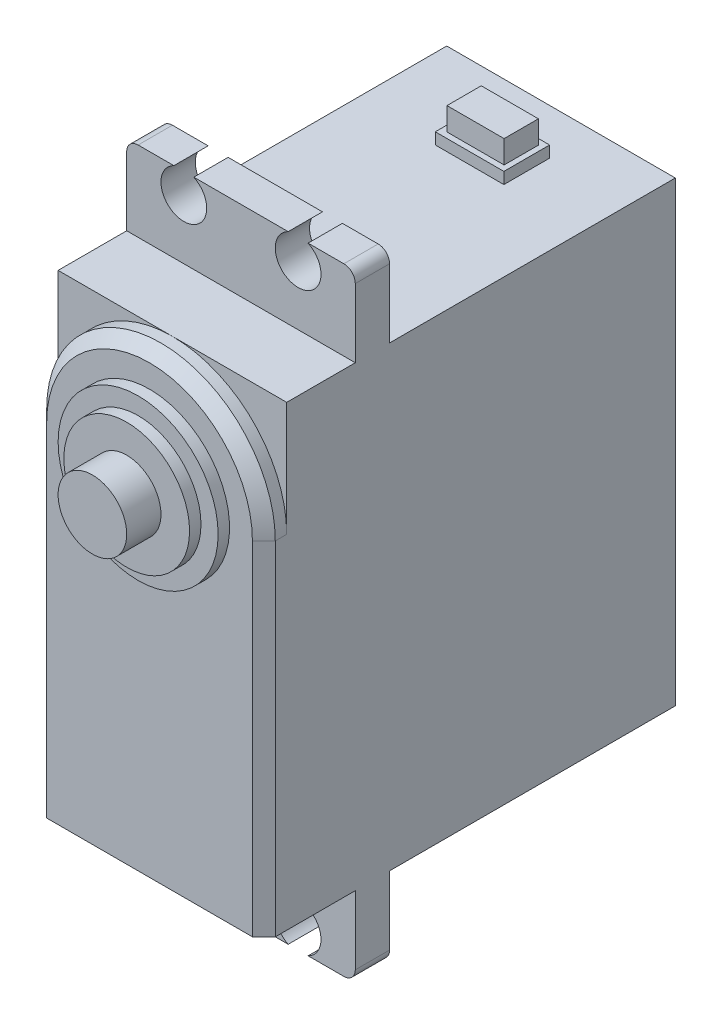
from build123d import *

# Parameters (mm, degrees)
SKETCH1_W            = 20
SKETCH1_H            = 40
BOSS_EXTRUDE1_DEPTH  = 36
CHAMFER1_SIZE        = 2
BOSS_EXTRUDE7_DEPTH  = 3
FILLET1_R            = 1
FILLET2_R            = 1
SKETCH3_W            = 6
SKETCH3_H            = 4
BOSS_EXTRUDE8_DEPTH  = 1
SKETCH4_W            = 5
SKETCH4_H            = 3
BOSS_EXTRUDE9_DEPTH  = 2
BOSS_EXTRUDE10_DEPTH = 2
CHAMFER2_SIZE        = 1
SKETCH6_R            = 7
BOSS_EXTRUDE11_DEPTH = 1
SKETCH7_R            = 5.5
BOSS_EXTRUDE12_DEPTH = 1
SKETCH8_R            = 3
BOSS_EXTRUDE13_DEPTH = 3


with BuildPart() as part:
    # Sketch1 → Boss-Extrude1 (new body)
    with BuildSketch(Plane.XY):
        Rectangle(SKETCH1_W, SKETCH1_H)
    extrude(amount=BOSS_EXTRUDE1_DEPTH)

    # Chamfer1
    chamfer1_edges = [part.edges().sort_by_distance(p)[0] for p in [
        (0, 20, 0),
        (-10, 0, 0),
        (0, -20, 0),
        (10, 0, 0),
    ]]
    chamfer(chamfer1_edges, length=CHAMFER1_SIZE)

    # Sketch2 → Boss-Extrude7 (add)
    with BuildSketch(Plane.XY.offset(27)):
        with BuildLine():
            Line((-10, 20), (10, 20))
            Line((10, 20), (10, 27))
            Line((10, 27), (5.871779789, 27))
            ThreePointArc((5.871779789, 27), (5, 23.2), (4.128220211, 27))
            Line((4.128220211, 27), (-4.128220211, 27))
            ThreePointArc((-4.128220211, 27), (-5, 23.2), (-5.871779789, 27))
            Line((-5.871779789, 27), (-10, 27))
            Line((-10, 27), (-10, 20))
        make_face()
    boss_extrude7 = extrude(amount=BOSS_EXTRUDE7_DEPTH)

    # Fillet1
    fillet1_edges = [part.edges().sort_by_distance(p)[0] for p in [
        (10, 27, 28.5),
        (-10, 27, 28.5),
    ]]
    fillet(fillet1_edges, radius=FILLET1_R)

    # Mirror1: Boss-Extrude7 across plane
    add(boss_extrude7.mirror(Plane.ZX))

    # Fillet2
    fillet2_edges = [part.edges().sort_by_distance(p)[0] for p in [
        (-10, -27, 28.5),
        (10, -27, 28.5),
    ]]
    fillet(fillet2_edges, radius=FILLET2_R)

    # Sketch3 → Boss-Extrude8 (add)
    with BuildSketch(Plane(origin=(0, 20, 0), x_dir=(1, 0, 0), z_dir=(0, 1, 0))):
        with Locations((0, -8)):
            Rectangle(SKETCH3_W, SKETCH3_H)
    extrude(amount=BOSS_EXTRUDE8_DEPTH)

    # Sketch4 → Boss-Extrude9 (add)
    with BuildSketch(Plane(origin=(0, 21, 0), x_dir=(1, 0, 0), z_dir=(0, 1, 0))):
        with Locations((0.024838868, -8.004270903)):
            Rectangle(SKETCH4_W, SKETCH4_H)
    extrude(amount=BOSS_EXTRUDE9_DEPTH)

    # Sketch5 → Boss-Extrude10 (add)
    with BuildSketch(Plane.XY.offset(36)):
        with BuildLine():
            Line((-10, 10), (-10, -20))
            Line((-10, -20), (10, -20))
            Line((10, -20), (10, 10))
            ThreePointArc((10, 10), (0, 20), (-10, 10))
        make_face()
    extrude(amount=BOSS_EXTRUDE10_DEPTH)

    # Chamfer2
    chamfer2_edges = [part.edges().sort_by_distance(p)[0] for p in [
        (10, -5, 38),
        (0, 20, 38),
        (-10, -5, 38),
    ]]
    chamfer(chamfer2_edges, length=CHAMFER2_SIZE)

    # Sketch6 → Boss-Extrude11 (add)
    with BuildSketch(Plane.XY.offset(38)):
        with Locations((0, 10)):
            Circle(SKETCH6_R)
    extrude(amount=BOSS_EXTRUDE11_DEPTH)

    # Sketch7 → Boss-Extrude12 (add)
    with BuildSketch(Plane.XY.offset(39)):
        with Locations((0, 10)):
            Circle(SKETCH7_R)
    extrude(amount=BOSS_EXTRUDE12_DEPTH)

    # Sketch8 → Boss-Extrude13 (add)
    with BuildSketch(Plane.XY.offset(40)):
        with Locations((0, 10)):
            Circle(SKETCH8_R)
    extrude(amount=BOSS_EXTRUDE13_DEPTH)


solid = part.part
